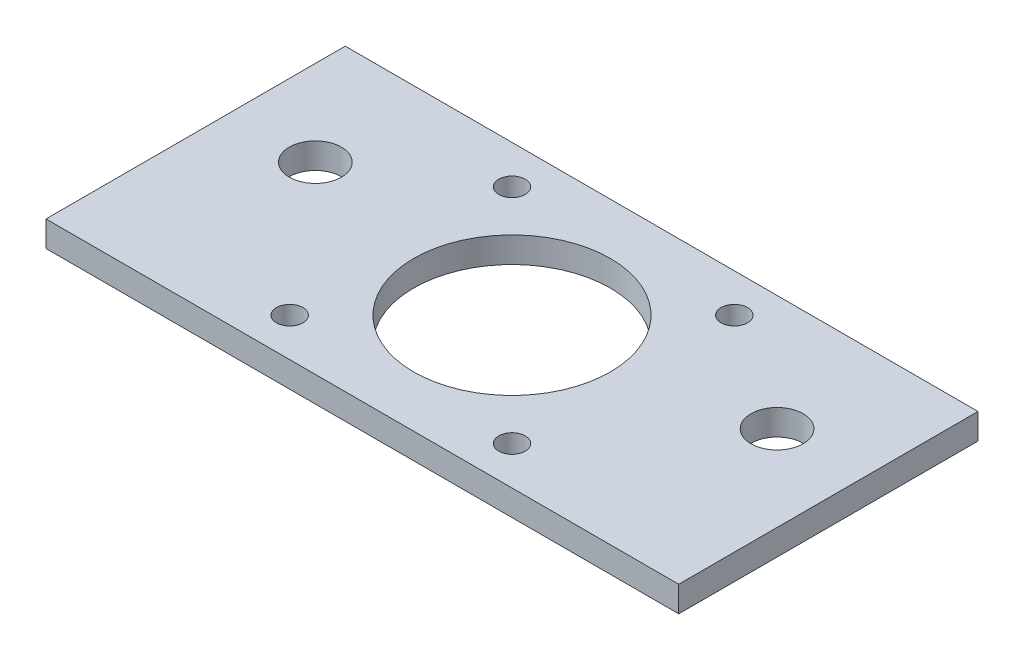
from build123d import *

# Parameters (mm, degrees)
SKETCH_1_W          = 74
SKETCH_1_H          = 35
EXTRUDE_1_DEPTH     = 3
SKETCH_3_R          = 1.55
CUT_EXTRUDE_1_DEPTH = 10
SKETCH_4_R          = 3.05
CUT_EXTRUDE_2_DEPTH = 10
SKETCH_5_R          = 11.5
CUT_EXTRUDE_3_DEPTH = 10


with BuildPart() as part:
    # 草图1 → 凸台-拉伸1 (new body)
    with BuildSketch(Plane(origin=(0, 0, 0), x_dir=(1, 0, 0), z_dir=(0, 1, 0))):
        Rectangle(SKETCH_1_W, SKETCH_1_H)
    extrude(amount=EXTRUDE_1_DEPTH)

    # 草图3 → 切除-拉伸1 (cut)
    with BuildSketch(Plane(origin=(0, 0, 0), x_dir=(-1, 0, 0), z_dir=(0, -1, 0))):
        with Locations(Location((13, -13, 0), (0, 0, 90))):
            Circle(SKETCH_3_R)
        with Locations(Location((-13, -13, 0), (0, 0, 90))):
            Circle(SKETCH_3_R)
        with Locations(Location((-13, 13, 0), (0, 0, 90))):
            Circle(SKETCH_3_R)
        with Locations(Location((13, 13, 0), (0, 0, 90))):
            Circle(SKETCH_3_R)
    extrude(amount=-CUT_EXTRUDE_1_DEPTH, mode=Mode.SUBTRACT)

    # 草图4 → 切除-拉伸2 (cut)
    with BuildSketch(Plane(origin=(0, 3, 0), x_dir=(1, 0, 0), z_dir=(0, 1, 0))):
        with Locations(Location((-27, 4, 0), (0, 0, 270))):
            Circle(SKETCH_4_R)
        with Locations(Location((27, 4, 0), (0, 0, 270))):
            Circle(SKETCH_4_R)
    extrude(amount=-CUT_EXTRUDE_2_DEPTH, mode=Mode.SUBTRACT)

    # 草图5 → 切除-拉伸3 (cut)
    with BuildSketch(Plane(origin=(0, 0, 0), x_dir=(-1, 0, 0), z_dir=(0, -1, 0))):
        with Locations(Location((0, 0, 0), (0, 0, 90))):
            Circle(SKETCH_5_R)
    extrude(amount=-CUT_EXTRUDE_3_DEPTH, mode=Mode.SUBTRACT)


solid = part.part
